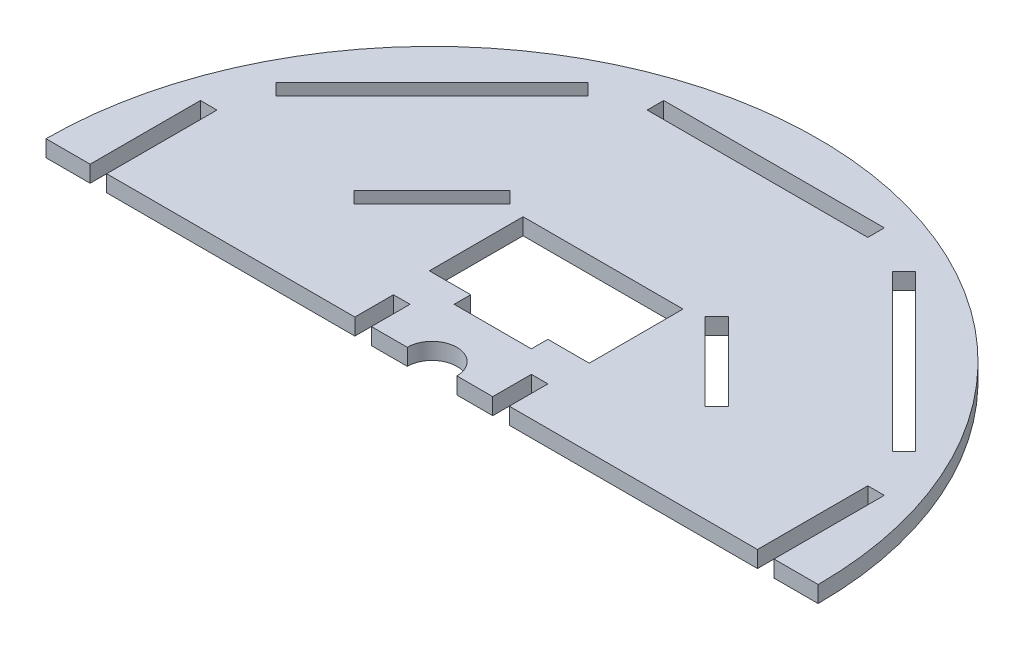
from build123d import *

# Parameters (mm, degrees)
SALIENTE_EXTRUIR1_DEPTH = 3


with BuildPart() as part:
    # Croquis1 → Saliente-Extruir1 (new body)
    with BuildSketch(Plane(origin=(0, 0, 0), x_dir=(1, 0, 0), z_dir=(0, 1, 0))):
        with BuildLine():
            Line((11, 0), (11, 7))
            Line((11, 7), (14, 7))
            Line((14, 7), (14, 0))
            Line((14, 0), (17, 0))
            Line((17, 0), (59, 0))
            Line((59, 0), (59, 20))
            Line((59, 20), (62, 20))
            Line((62, 20), (62, 0))
            Line((62, 0), (70, 0))
            ThreePointArc((70, 0), (0, 70), (-70, 0))
            Line((-70, 0), (-62, 0))
            Line((-62, 0), (-62, 20))
            Line((-62, 20), (-59, 20))
            Line((-59, 20), (-59, 0))
            Line((-59, 0), (-17, 0))
            Line((-17, 0), (-14, 0))
            Line((-14, 0), (-14, 7))
            Line((-14, 7), (-11, 7))
            Line((-11, 7), (-11, 0))
            Line((-11, 0), (-4.5, 0))
            ThreePointArc((-4.5, 0), (0, 4.5), (4.5, 0))
            Line((4.5, 0), (11, 0))
        make_face()
        Polygon((0, 11), (7, 11), (7, 14), (14.5, 14), (14.5, 31), (-14.5, 31), (-14.5, 14), (-7, 14), (-7, 11), align=None, mode=Mode.SUBTRACT)
        Polygon((24.748737342, 24.748737342), (31.819805153, 17.67766953), (33.941125497, 19.798989873), (19.798989873, 33.941125497), (17.67766953, 31.819805153), align=None, mode=Mode.SUBTRACT)
        Polygon((-24.748737342, 24.748737342), (-17.67766953, 31.819805153), (-19.798989873, 33.941125497), (-33.941125497, 19.798989873), (-31.819805153, 17.67766953), align=None, mode=Mode.SUBTRACT)
        Polygon((0, 62), (20, 62), (20, 59), (-20, 59), (-20, 62), align=None, mode=Mode.SUBTRACT)
        Polygon((55.861435714, 27.577164466), (27.577164466, 55.861435714), (29.69848481, 57.982756057), (43.840620434, 43.840620434), (57.982756057, 29.69848481), align=None, mode=Mode.SUBTRACT)
        Polygon((-27.577164466, 55.861435714), (-55.861435714, 27.577164466), (-57.982756057, 29.69848481), (-43.840620434, 43.840620434), (-29.69848481, 57.982756057), align=None, mode=Mode.SUBTRACT)
    extrude(amount=SALIENTE_EXTRUIR1_DEPTH)


solid = part.part
